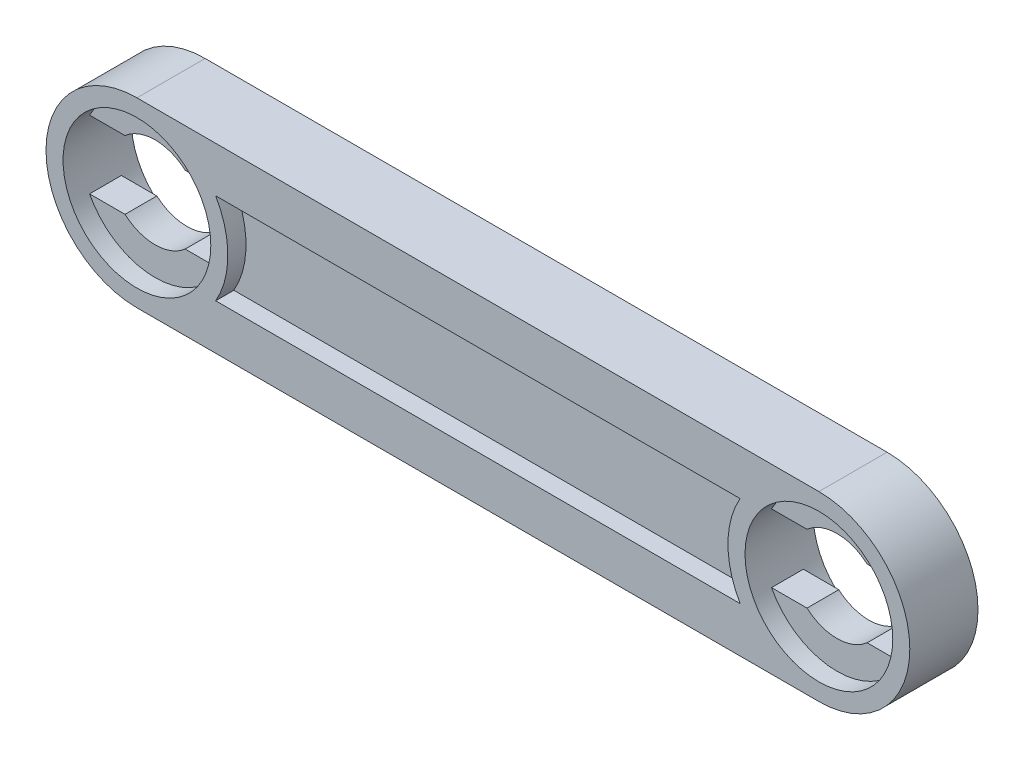
from build123d import *

# Parameters (mm, degrees)
EXTRUDE_1_DEPTH     = 3
CUT_EXTRUDE_1_REACH = 36.366
SKETCH_3_R          = 3.25
CUT_EXTRUDE_2_DEPTH = 0.8
CUT_EXTRUDE_START   = -2.2
SKETCH_3_2_R        = 3.25
CUT_EXTRUDE_3_DEPTH = 0.8
CUT_EXTRUDE_4_DEPTH = 0.8
SKETCH_5_W          = 22
SKETCH_5_H          = 4
CUT_EXTRUDE_5_DEPTH = 0.8


with BuildPart() as part:
    # 草图1 → 凸台-拉伸1 (new body)
    with BuildSketch(Plane.XY):
        with BuildLine():
            Line((0, 4), (30, 4))
            ThreePointArc((30, 4), (34, 0), (30, -4))
            Line((30, -4), (0, -4))
            ThreePointArc((0, -4), (-4, 0), (0, 4))
        make_face()
    extrude(amount=-EXTRUDE_1_DEPTH)

    # 草图2 → 切除-拉伸1 (cut, up to next)
    with BuildSketch(Plane.XY, mode=Mode.PRIVATE) as cut_extrude_1_sk1:
        with BuildLine():
            Line((1.322875656, -1.5), (2.883140649, -1.5))
            ThreePointArc((2.883140649, -1.5), (3.25, 0), (2.883140649, 1.5))
            Line((2.883140649, 1.5), (1.322875656, 1.5))
            ThreePointArc((1.322875656, 1.5), (0, 2), (-1.322875656, 1.5))
            Line((-1.322875656, 1.5), (-2.883140649, 1.5))
            ThreePointArc((-2.883140649, 1.5), (-3.25, 0), (-2.883140649, -1.5))
            Line((-2.883140649, -1.5), (-1.322875656, -1.5))
            ThreePointArc((-1.322875656, -1.5), (0, -2), (1.322875656, -1.5))
        make_face()
    cut_extrude_1_tool1 = extrude(cut_extrude_1_sk1.sketch, amount=-CUT_EXTRUDE_1_REACH, mode=Mode.PRIVATE) & part.part
    cut_extrude_1 = cut_extrude_1_tool1.solids().sort_by_distance((0, 0, 0))[0]
    add(cut_extrude_1, mode=Mode.SUBTRACT)

    # 草图3 → 切除-拉伸2 (cut)
    with BuildSketch(Plane.XY):
        Circle(SKETCH_3_R)
    cut_extrude_2 = extrude(amount=-CUT_EXTRUDE_2_DEPTH, mode=Mode.SUBTRACT)

    # 草图3<2> → 切除-拉伸3 (cut)
    with BuildSketch(Plane.XY.offset(CUT_EXTRUDE_START)):
        Circle(SKETCH_3_2_R)
    cut_extrude_3 = extrude(amount=-CUT_EXTRUDE_3_DEPTH, mode=Mode.SUBTRACT)

    # 镜向1: 切除-拉伸1, 切除-拉伸2, 切除-拉伸3 across plane
    add(cut_extrude_1.mirror(Plane(origin=(15, 0, 0), x_dir=(0, 0, 1), z_dir=(1, 0, 0))), mode=Mode.SUBTRACT)
    add(cut_extrude_2.mirror(Plane(origin=(15, 0, 0), x_dir=(0, 0, 1), z_dir=(1, 0, 0))), mode=Mode.SUBTRACT)
    add(cut_extrude_3.mirror(Plane(origin=(15, 0, 0), x_dir=(0, 0, 1), z_dir=(1, 0, 0))), mode=Mode.SUBTRACT)

    # 草图4 → 切除-拉伸4 (cut)
    with BuildSketch(Plane.XY):
        with BuildLine():
            Line((3.464101615, 2), (26.535898385, 2))
            ThreePointArc((26.535898385, 2), (26, 0), (26.535898385, -2))
            Line((26.535898385, -2), (3.464101615, -2))
            ThreePointArc((3.464101615, -2), (4, 0), (3.464101615, 2))
        make_face()
    extrude(amount=-CUT_EXTRUDE_4_DEPTH, mode=Mode.SUBTRACT)

    # 草图5 → 切除-拉伸5 (cut)
    with BuildSketch(Plane(origin=(0, 0, -3), x_dir=(-1, 0, 0), z_dir=(0, 0, -1))):
        with Locations((-15, 0)):
            Rectangle(SKETCH_5_W, SKETCH_5_H)
    extrude(amount=-CUT_EXTRUDE_5_DEPTH, mode=Mode.SUBTRACT)


solid = part.part
